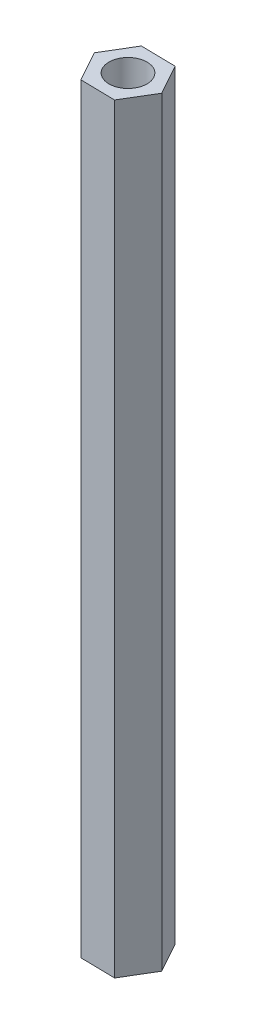
from build123d import *

# Parameters (mm, degrees)
SKETCH1_R           = 1.5
BOSS_EXTRUDE1_DEPTH = 60


with BuildPart() as part:
    # Sketch1 → Boss-Extrude1 (new body)
    with BuildSketch(Plane(origin=(0, 0, 0), x_dir=(1, 0, 0), z_dir=(0, 1, 0))):
        Polygon((-1.313414072, 2.374505593), (-2.713089201, 0.049802845), (-1.399675129, -2.324702748), (1.313414072, -2.374505593), (2.713089201, -0.049802845), (1.399675129, 2.324702748), align=None)
        with Locations(Location((0, 0, 0), (0, 0, 270))):
            Circle(SKETCH1_R, mode=Mode.SUBTRACT)
    extrude(amount=BOSS_EXTRUDE1_DEPTH)


solid = part.part
